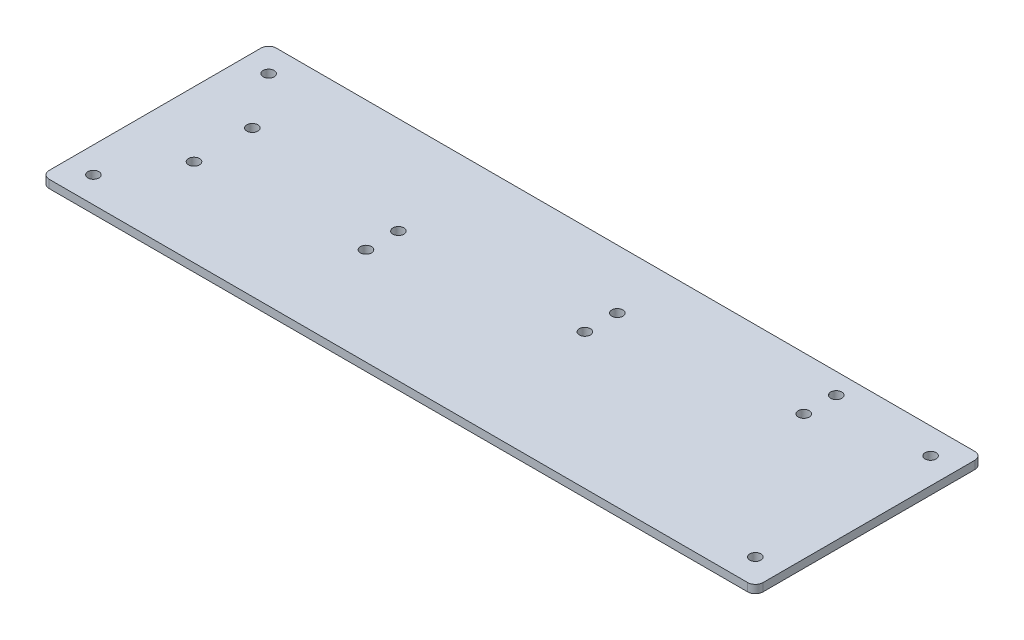
from build123d import *

# Parameters (mm, degrees)
SKETCH1_W           = 279.4
SKETCH1_H           = 88.9
BOSS_EXTRUDE1_DEPTH = 3.175
SKETCH2_R           = 2.16
SKETCH2_R_2         = 2.159
CUT_EXTRUDE1_DEPTH  = 6.35
FILLET1_R           = 3


with BuildPart() as part:
    # Sketch1 → Boss-Extrude1 (new body)
    with BuildSketch(Plane(origin=(0, 0, 0), x_dir=(1, 0, 0), z_dir=(0, 1, 0))):
        Rectangle(SKETCH1_W, SKETCH1_H)
    extrude(amount=BOSS_EXTRUDE1_DEPTH)

    # Sketch2 → Cut-Extrude1 (cut)
    with BuildSketch(Plane(origin=(0, 3.175, 0), x_dir=(1, 0, 0), z_dir=(0, 1, 0))):
        with Locations(Location((-114.3, 12.7, 0), (0, 0, 270))):
            Circle(SKETCH2_R)
        with Locations(Location((-114.3, -10.16, 0), (0, 0, 270))):
            Circle(SKETCH2_R)
        with Locations(Location((-50.8, 6.35, 0), (0, 0, 270))):
            Circle(SKETCH2_R_2)
        with Locations(Location((-50.8, -6.35, 0), (0, 0, 270))):
            Circle(SKETCH2_R_2)
        with Locations(Location((19.851601201, 8.667461428, 0), (0, 0, 270))):
            Circle(SKETCH2_R_2)
        with Locations(Location((19.851601201, 21.367461428, 0), (0, 0, 270))):
            Circle(SKETCH2_R_2)
        with Locations(Location((90.503202402, 23.684922856, 0), (0, 0, 270))):
            Circle(SKETCH2_R_2)
        with Locations(Location((90.503202402, 36.384922856, 0), (0, 0, 270))):
            Circle(SKETCH2_R_2)
        with Locations(Location((129.54, -34.29, 0), (0, 0, 270))):
            Circle(SKETCH2_R_2)
        with Locations(Location((-129.54, -34.29, 0), (0, 0, 270))):
            Circle(SKETCH2_R_2)
        with Locations(Location((-129.54, 34.29, 0), (0, 0, 270))):
            Circle(SKETCH2_R_2)
        with Locations(Location((129.54, 34.29, 0), (0, 0, 270))):
            Circle(SKETCH2_R_2)
    extrude(amount=-CUT_EXTRUDE1_DEPTH, mode=Mode.SUBTRACT)

    # Fillet1
    fillet1_edges = [part.edges().sort_by_distance(p)[0] for p in [
        (139.7, 1.5875, 44.45),
        (-139.7, 1.5875, 44.45),
        (-139.7, 1.5875, -44.45),
        (139.7, 1.5875, -44.45),
    ]]
    fillet(fillet1_edges, radius=FILLET1_R)


solid = part.part
